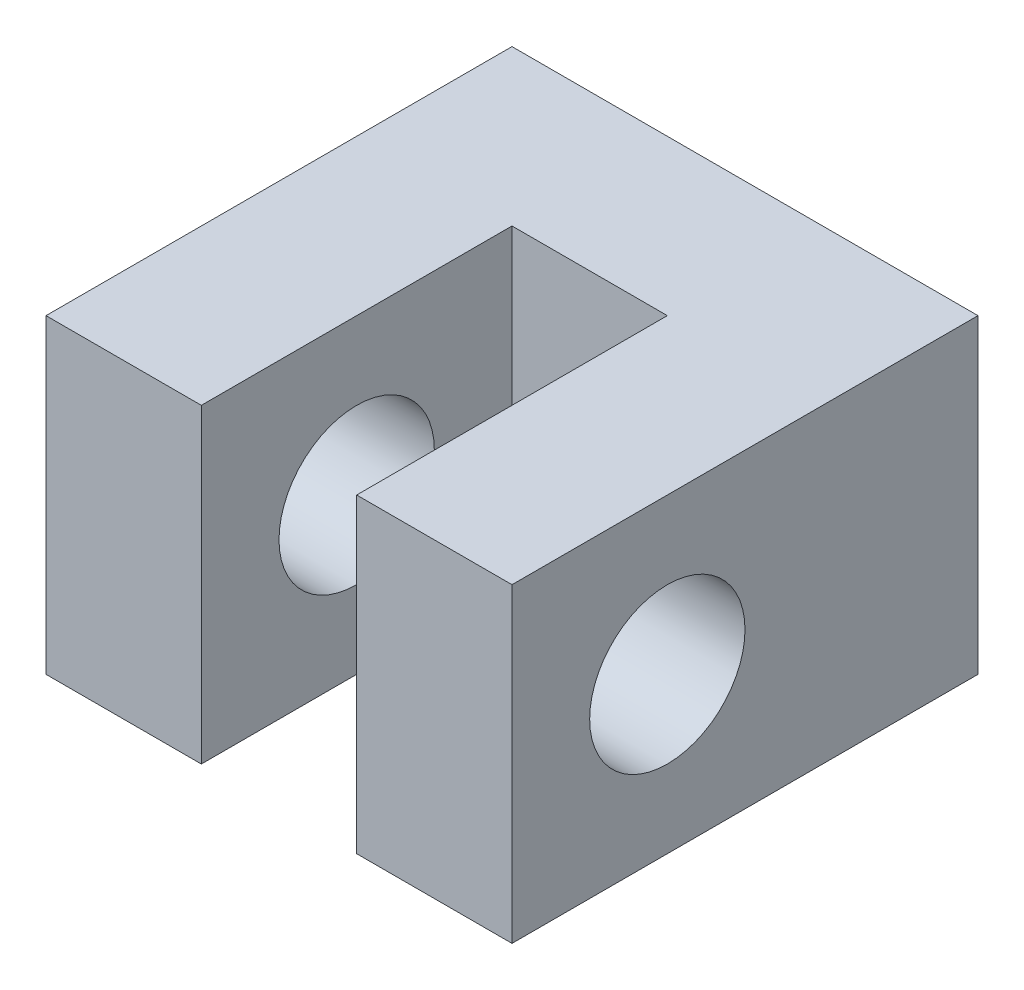
from build123d import *

# Parameters (mm, degrees)
BOSS_EXTRUDE2_DEPTH = 6.35
SKETCH3_R           = 3.175
CUT_EXTRUDE1_DEPTH  = 28.679008291
SKETCH1_R           = 3.175
CUT_EXTRUDE2_DEPTH  = 2.54


with BuildPart() as part:
    # Sketch2 → Boss-Extrude2 (new, symmetric)
    with BuildSketch(Plane(origin=(0, 0, 0), x_dir=(1, 0, 0), z_dir=(0, 1, 0))):
        Polygon((-9.525, 0), (9.525, 0), (9.525, -19.05), (3.175, -19.05), (3.175, -6.35), (-3.175, -6.35), (-3.175, -19.05), (-9.525, -19.05), align=None)
    extrude(amount=BOSS_EXTRUDE2_DEPTH, both=True)

    # Sketch3 → Cut-Extrude1 (cut, through all)
    with BuildSketch(Plane.ZY.offset(9.525)):
        with Locations((12.7, 0)):
            Circle(SKETCH3_R)
    extrude(amount=-CUT_EXTRUDE1_DEPTH, mode=Mode.SUBTRACT)

    # Sketch1 → Cut-Extrude2 (cut)
    with BuildSketch(Plane.XY):
        Circle(SKETCH1_R)
    extrude(amount=CUT_EXTRUDE2_DEPTH, mode=Mode.SUBTRACT)


solid = part.part
